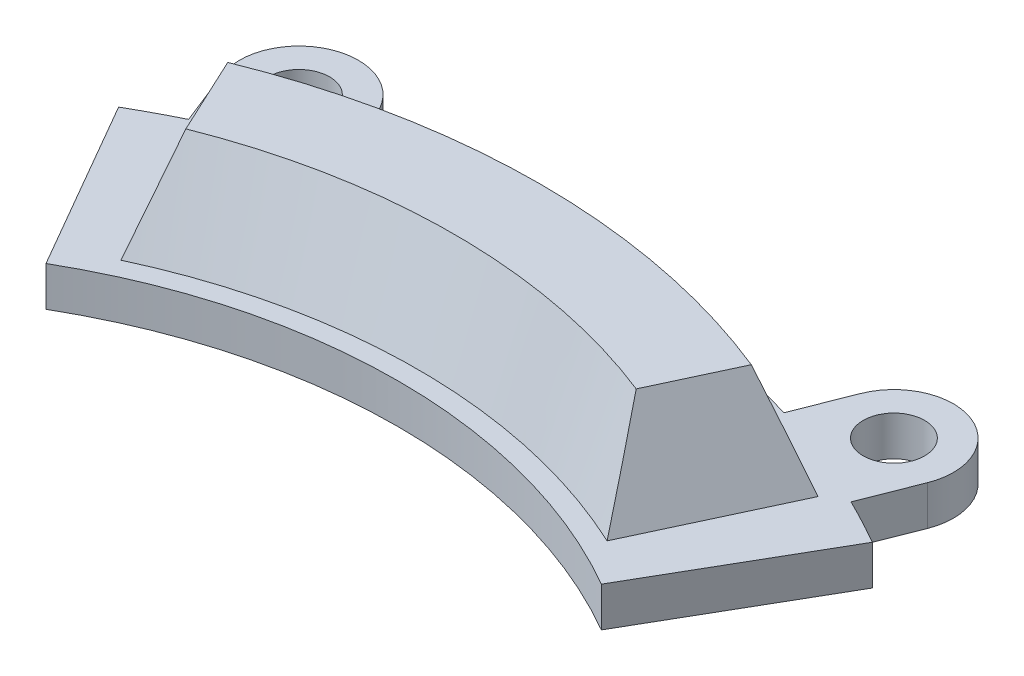
from build123d import *

# Parameters (mm, degrees)
SKETCH1_R           = 1.55
BOSS_EXTRUDE1_DEPTH = 2
BOSS_EXTRUDE2_DEPTH = 5
BOSS_EXTRUDE2_DRAFT = 20


with BuildPart() as part:
    # Sketch1 → Boss-Extrude1 (new body)
    with BuildSketch(Plane(origin=(0, 0, 0), x_dir=(1, 0, 0), z_dir=(0, 1, 0))):
        with BuildLine():
            Line((14, 24.248711306), (19, 32.908965344))
            ThreePointArc((19, 32.908965344), (17.860130505, 33.541254275), (16.699245775, 34.134076676))
            Line((16.699245775, 34.134076676), (17.790465664, 36.898500396))
            ThreePointArc((17.790465664, 36.898500396), (16.101499604, 40.790465664), (12.209534336, 39.101499604))
            Line((12.209534336, 39.101499604), (11.118314447, 36.337075885))
            ThreePointArc((11.118314447, 36.337075885), (0, 38), (-11.118314447, 36.337075885))
            Line((-11.118314447, 36.337075885), (-12.209534336, 39.101499604))
            ThreePointArc((-12.209534336, 39.101499604), (-16.101499604, 40.790465664), (-17.790465664, 36.898500396))
            Line((-17.790465664, 36.898500396), (-16.699245775, 34.134076676))
            ThreePointArc((-16.699245775, 34.134076676), (-17.860130505, 33.541254275), (-19, 32.908965344))
            Line((-19, 32.908965344), (-14, 24.248711306))
            ThreePointArc((-14, 24.248711306), (0, 28), (14, 24.248711306))
        make_face()
        with Locations(Location((-15, 38, 0), (0, 0, 270))):
            Circle(SKETCH1_R, mode=Mode.SUBTRACT)
        with Locations(Location((15, 38, 0), (0, 0, 270))):
            Circle(SKETCH1_R, mode=Mode.SUBTRACT)
    extrude(amount=BOSS_EXTRUDE1_DEPTH)


with BuildPart() as boss_extrude2_tool:
    # Sketch2 → Boss-Extrude2 (with draft: the straight prism first)
    with BuildSketch(Plane(origin=(0, 2, 0), x_dir=(1, 0, 0), z_dir=(0, 1, 0))):
        with BuildLine():
            ThreePointArc((-12.25592959, 26.282925824), (0, 29), (12.25592959, 26.282925824))
            Line((12.25592959, 26.282925824), (15.636875684, 33.53338812))
            ThreePointArc((15.636875684, 33.53338812), (0, 37), (-15.636875684, 33.53338812))
            Line((-15.636875684, 33.53338812), (-12.25592959, 26.282925824))
        make_face()
    extrude(amount=BOSS_EXTRUDE2_DEPTH)
    # Boss-Extrude2: the draft: its side faces are tilted about the plane it starts from
    boss_extrude2_sides = [boss_extrude2_tool.faces().sort_by_distance(p)[0] for p in [
        (0, 4.5, -29),
        (13.946402637, 4.5, -29.908156972),
        (0, 4.5, -37),
        (-13.946402637, 4.5, -29.908156972),
    ]]
    draft(boss_extrude2_sides, Plane(origin=(0, 2, 0), x_dir=(1, 0, 0), z_dir=(0, 1, 0)), BOSS_EXTRUDE2_DRAFT)


with BuildPart() as part_1:
    add(part.part)

    # Boss-Extrude2: add boss_extrude2_tool
    add(boss_extrude2_tool.part)


solid = part_1.part
